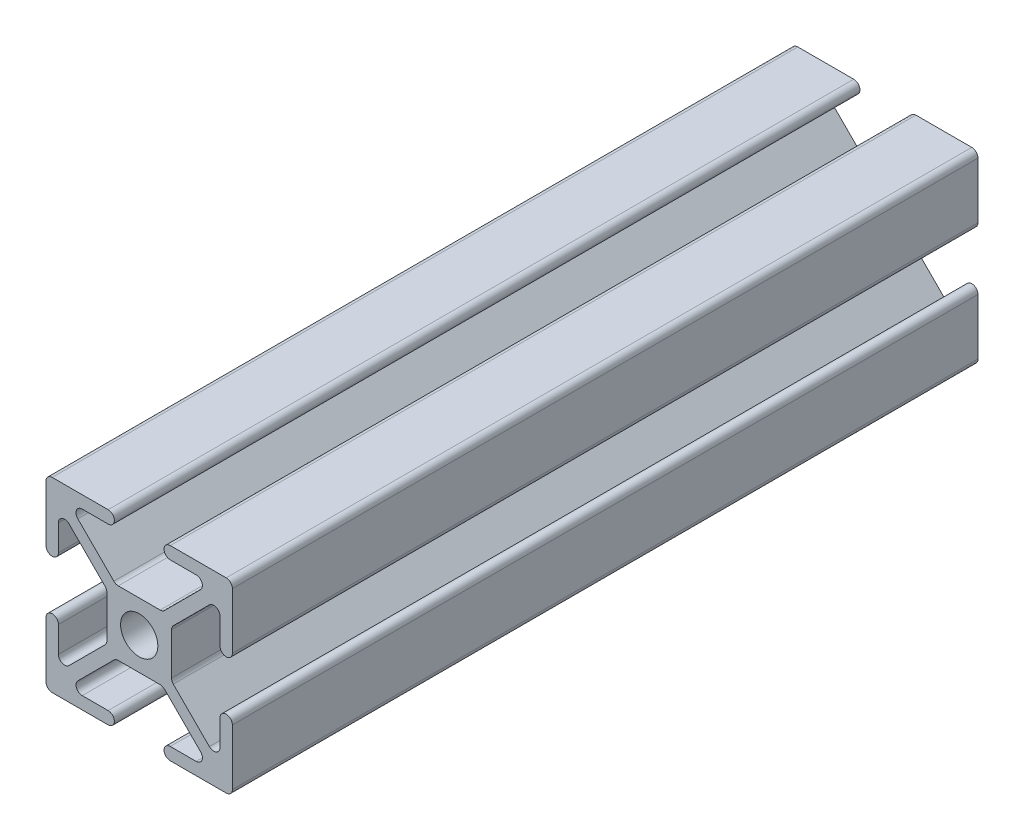
from build123d import *

# Parameters (mm, degrees)
SALIENTE_EXTRUIR1_DEPTH = 120
CROQUIS2_R              = 3
CORTAR_EXTRUIR1_DEPTH   = 122.86057607
CORTAR_EXTRUIR3_DEPTH   = 122.86057607


with BuildPart() as part:
    # Croquis1 → Saliente-Extruir1 (new body)
    with BuildSketch(Plane.XY):
        with BuildLine():
            Line((-14, 15), (14, 15))
            ThreePointArc((14, 15), (14.707106781, 14.707106781), (15, 14))
            Line((15, 14), (15, -14))
            ThreePointArc((15, -14), (14.707106781, -14.707106781), (14, -15))
            Line((14, -15), (-14, -15))
            ThreePointArc((-14, -15), (-14.707106781, -14.707106781), (-15, -14))
            Line((-15, -14), (-15, 14))
            ThreePointArc((-15, 14), (-14.707106781, 14.707106781), (-14, 15))
        make_face()
    extrude(amount=-SALIENTE_EXTRUIR1_DEPTH)

    # Croquis2 → Cortar-Extruir1 (cut, through all)
    with BuildSketch(Plane.XY):
        Circle(CROQUIS2_R)
    extrude(amount=-CORTAR_EXTRUIR1_DEPTH, mode=Mode.SUBTRACT)

    # Croquis3 → Cortar-Extruir3 (cut, through all)
    with BuildSketch(Plane.XY):
        with BuildLine():
            Line((-5.492893219, 4.078679656), (-11.292893219, 9.878679656))
            ThreePointArc((-11.292893219, 9.878679656), (-12.382683432, 10.095452408), (-13, 9.171572875))
            Line((-13, 9.171572875), (-13, 5))
            ThreePointArc((-13, 5), (-14, 4), (-15, 5))
            Line((-15, 5), (-15, -5))
            ThreePointArc((-15, -5), (-14, -4), (-13, -5))
            Line((-13, -5), (-13, -9.171572875))
            ThreePointArc((-13, -9.171572875), (-12.382683432, -10.095452408), (-11.292893219, -9.878679656))
            Line((-11.292893219, -9.878679656), (-5.492893219, -4.078679656))
            ThreePointArc((-5.492893219, -4.078679656), (-5.276120467, -3.754256308), (-5.2, -3.371572875))
            Line((-5.2, -3.371572875), (-5.2, 3.371572875))
            ThreePointArc((-5.2, 3.371572875), (-5.276120467, 3.754256308), (-5.492893219, 4.078679656))
        make_face()
        with BuildLine():
            ThreePointArc((-9.171572875, 13), (-10.095452408, 12.382683432), (-9.878679656, 11.292893219))
            Line((-9.878679656, 11.292893219), (-4.078679656, 5.492893219))
            ThreePointArc((-4.078679656, 5.492893219), (-3.754256308, 5.276120467), (-3.371572875, 5.2))
            Line((-3.371572875, 5.2), (3.371572875, 5.2))
            ThreePointArc((3.371572875, 5.2), (3.754256308, 5.276120467), (4.078679656, 5.492893219))
            Line((4.078679656, 5.492893219), (9.878679656, 11.292893219))
            ThreePointArc((9.878679656, 11.292893219), (10.095452408, 12.382683432), (9.171572875, 13))
            Line((9.171572875, 13), (5, 13))
            ThreePointArc((5, 13), (4, 14), (5, 15))
            Line((5, 15), (-5, 15))
            ThreePointArc((-5, 15), (-4.292893219, 14.707106781), (-4, 14))
            ThreePointArc((-4, 14), (-4.292893219, 13.292893219), (-5, 13))
            Line((-5, 13), (-9.171572875, 13))
        make_face()
        with BuildLine():
            Line((9.878679656, -11.292893219), (4.078679656, -5.492893219))
            ThreePointArc((4.078679656, -5.492893219), (3.754256308, -5.276120467), (3.371572875, -5.2))
            Line((3.371572875, -5.2), (-3.371572875, -5.2))
            ThreePointArc((-3.371572875, -5.2), (-3.754256308, -5.276120467), (-4.078679656, -5.492893219))
            Line((-4.078679656, -5.492893219), (-9.878679656, -11.292893219))
            ThreePointArc((-9.878679656, -11.292893219), (-10.095452408, -12.382683432), (-9.171572875, -13))
            Line((-9.171572875, -13), (-5, -13))
            ThreePointArc((-5, -13), (-4.292893219, -13.292893219), (-4, -14))
            ThreePointArc((-4, -14), (-4.292893219, -14.707106781), (-5, -15))
            Line((-5, -15), (5, -15))
            ThreePointArc((5, -15), (4, -14), (5, -13))
            Line((5, -13), (9.171572875, -13))
            ThreePointArc((9.171572875, -13), (10.095452408, -12.382683432), (9.878679656, -11.292893219))
        make_face()
        with BuildLine():
            ThreePointArc((13, 9.171572875), (12.382683432, 10.095452408), (11.292893219, 9.878679656))
            Line((11.292893219, 9.878679656), (5.492893219, 4.078679656))
            ThreePointArc((5.492893219, 4.078679656), (5.276120467, 3.754256308), (5.2, 3.371572875))
            Line((5.2, 3.371572875), (5.2, -3.371572875))
            ThreePointArc((5.2, -3.371572875), (5.276120467, -3.754256308), (5.492893219, -4.078679656))
            Line((5.492893219, -4.078679656), (11.292893219, -9.878679656))
            ThreePointArc((11.292893219, -9.878679656), (12.382683432, -10.095452408), (13, -9.171572875))
            Line((13, -9.171572875), (13, -5))
            ThreePointArc((13, -5), (14, -4), (15, -5))
            Line((15, -5), (15, 5))
            ThreePointArc((15, 5), (14, 4), (13, 5))
            Line((13, 5), (13, 9.171572875))
        make_face()
    extrude(amount=-CORTAR_EXTRUIR3_DEPTH, mode=Mode.SUBTRACT)


solid = part.part
